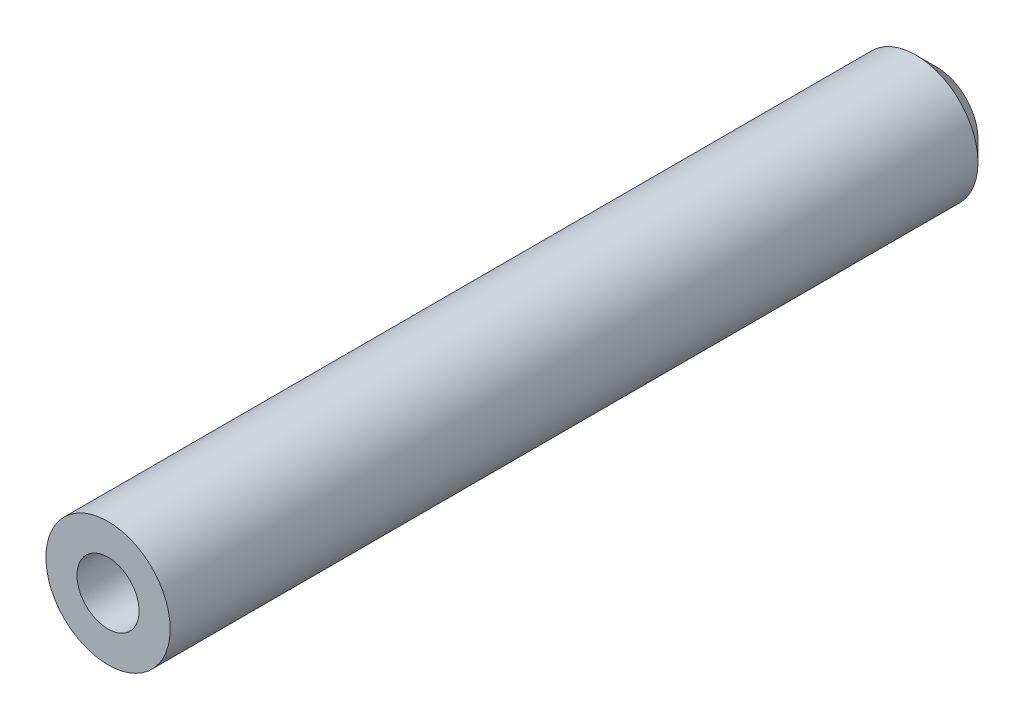
from build123d import *


with BuildPart() as part:
    # Sketch1 → Revolve1 (revolve)
    with BuildSketch(Plane(origin=(0, 0, 0), x_dir=(1, 0, 0), z_dir=(0, 1, 0)), mode=Mode.PRIVATE) as revolve1_sk:
        Polygon((-3, 39), (-2, 40), (-1.5, 40), (-1.5, 0), (-3, 0), align=None)
    revolve(revolve1_sk.sketch.rotate(Axis((0, 0, 0), (0, 0, -1)), 180), axis=Axis((0, 0, 0), (0, 0, -1)))


solid = part.part
